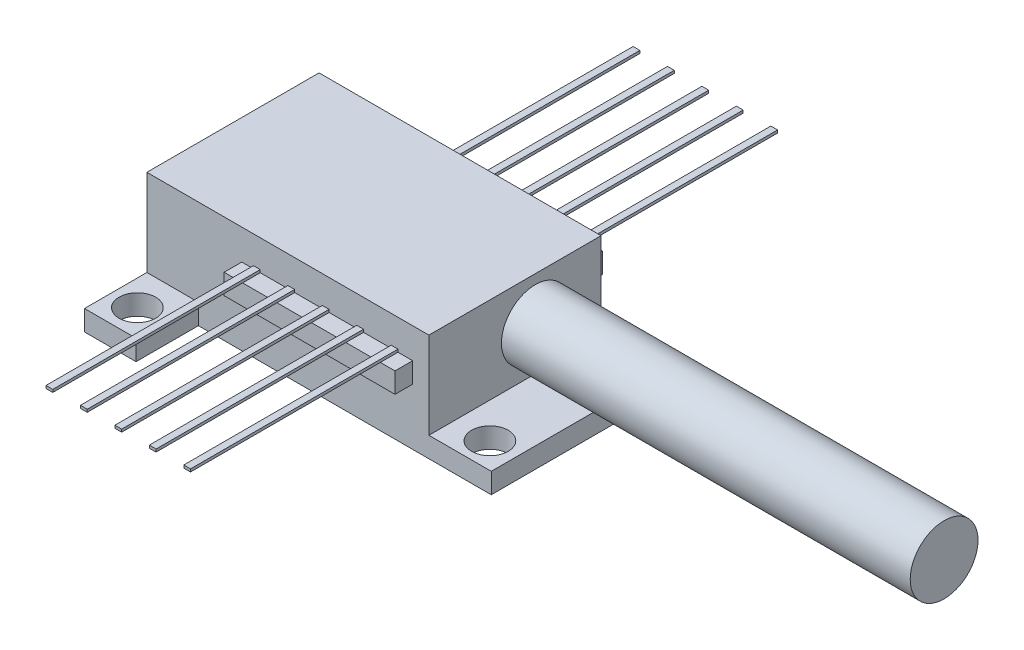
from build123d import *

# Parameters (mm, degrees)
SKETCH1_W               = 20.8
SKETCH1_H               = 12.7
BOSS_EXTRUDE1_DEPTH     = 6.4
BOSS_EXTRUDE2_DEPTH     = 1.5
SKETCH5_R               = 1.35
CUT_EXTRUDE1_DEPTH      = 21.181984541
SKETCH8_R               = 2.5
BOSS_EXTRUDE3_DEPTH     = 30.15
SKETCH9_W               = 12.6
SKETCH9_H               = 1.3
BOSS_EXTRUDE4_DEPTH     = 1.5
SKETCH10_W              = 0.5
SKETCH10_H              = 15.3
BOSS_EXTRUDE5_DEPTH     = 0.2
LPATTERN1_COUNT         = 5
LPATTERN1_PITCH         = 2.54
MIRROR2_COPY_1_SKETCH_W = 0.5
MIRROR2_COPY_1_SKETCH_H = 15.3
MIRROR2_COPY_1_DEPTH    = 0.2
MIRROR2_COPY_2_SKETCH_W = 0.5
MIRROR2_COPY_2_SKETCH_H = 15.3
MIRROR2_COPY_2_DEPTH    = 0.2
MIRROR2_COPY_3_SKETCH_W = 0.5
MIRROR2_COPY_3_SKETCH_H = 15.3
MIRROR2_COPY_3_DEPTH    = 0.2
MIRROR2_COPY_4_SKETCH_W = 0.5
MIRROR2_COPY_4_SKETCH_H = 15.3
MIRROR2_COPY_4_DEPTH    = 0.2


with BuildPart() as part:
    # Sketch1 → Boss-Extrude1 (new body)
    with BuildSketch(Plane(origin=(0, 0, 0), x_dir=(1, 0, 0), z_dir=(0, 1, 0))):
        Rectangle(SKETCH1_W, SKETCH1_H)
    extrude(amount=BOSS_EXTRUDE1_DEPTH)

    # Sketch3 → Boss-Extrude2 (add)
    with BuildSketch(Plane.XZ):
        Polygon((-10.4, 10.95), (-6.6, 10.95), (-6.6, 6.35), (15, 6.35), (15, -6.35), (-6.6, -6.35), (-6.6, -10.95), (-10.4, -10.95), align=None)
    extrude(amount=BOSS_EXTRUDE2_DEPTH)

    # Sketch5 → Cut-Extrude1 (cut, through all)
    with BuildSketch(Plane.XZ.offset(1.5)):
        with Locations(Location((-8.5, 8.95, 0), (0, 0, 270))):
            Circle(SKETCH5_R)
        with Locations(Location((13, 4.45, 0), (0, 0, 270))):
            Circle(SKETCH5_R)
    cut_extrude1 = extrude(amount=-CUT_EXTRUDE1_DEPTH, mode=Mode.SUBTRACT)

    # Mirror3: Cut-Extrude1 across plane
    add(cut_extrude1.mirror(Plane.XY), mode=Mode.SUBTRACT)

    # Sketch8 → Boss-Extrude3 (add)
    with BuildSketch(Plane(origin=(10.4, 0, 0), x_dir=(0, 0, -1), z_dir=(1, 0, 0))):
        with Locations(Location((1.5, 3.2, 0), (0, 0, 180))):
            Circle(SKETCH8_R)
    extrude(amount=BOSS_EXTRUDE3_DEPTH)

    # Sketch9 → Boss-Extrude4 (add)
    with BuildSketch(Plane(origin=(0, 2.665, 0), x_dir=(-1, 0, 0), z_dir=(0, -1, 0))):
        with Locations((-2.9, -7)):
            Rectangle(SKETCH9_W, SKETCH9_H)
    boss_extrude4 = extrude(amount=-BOSS_EXTRUDE4_DEPTH)

    # Sketch10 → Boss-Extrude5 (add)
    with BuildSketch(Plane(origin=(0, 4.165, 0), x_dir=(1, 0, 0), z_dir=(0, 1, 0))):
        with Locations((7.87, -14)):
            Rectangle(SKETCH10_W, SKETCH10_H)
    boss_extrude5 = extrude(amount=BOSS_EXTRUDE5_DEPTH)

    # LPattern1: Boss-Extrude5 ×5
    with Locations(*[(-i * LPATTERN1_PITCH, 0, 0) for i in range(1, LPATTERN1_COUNT)]):
        add(boss_extrude5)

    # Mirror2: Boss-Extrude4, Boss-Extrude5 across plane
    add(boss_extrude4.mirror(Plane.XY))
    add(boss_extrude5.mirror(Plane.XY))

    # Mirror2 copy 1 sketch → Mirror2 copy 1 (add)
    with BuildSketch(Plane(origin=(-2.54, 4.165, 0), x_dir=(1, 0, 0), z_dir=(0, 1, 0))):
        with Locations((7.87, 14)):
            Rectangle(MIRROR2_COPY_1_SKETCH_W, MIRROR2_COPY_1_SKETCH_H)
    extrude(amount=MIRROR2_COPY_1_DEPTH)

    # Mirror2 copy 2 sketch → Mirror2 copy 2 (add)
    with BuildSketch(Plane(origin=(-5.08, 4.165, 0), x_dir=(1, 0, 0), z_dir=(0, 1, 0))):
        with Locations((7.87, 14)):
            Rectangle(MIRROR2_COPY_2_SKETCH_W, MIRROR2_COPY_2_SKETCH_H)
    extrude(amount=MIRROR2_COPY_2_DEPTH)

    # Mirror2 copy 3 sketch → Mirror2 copy 3 (add)
    with BuildSketch(Plane(origin=(-7.62, 4.165, 0), x_dir=(1, 0, 0), z_dir=(0, 1, 0))):
        with Locations((7.87, 14)):
            Rectangle(MIRROR2_COPY_3_SKETCH_W, MIRROR2_COPY_3_SKETCH_H)
    extrude(amount=MIRROR2_COPY_3_DEPTH)

    # Mirror2 copy 4 sketch → Mirror2 copy 4 (add)
    with BuildSketch(Plane(origin=(-10.16, 4.165, 0), x_dir=(1, 0, 0), z_dir=(0, 1, 0))):
        with Locations((7.87, 14)):
            Rectangle(MIRROR2_COPY_4_SKETCH_W, MIRROR2_COPY_4_SKETCH_H)
    extrude(amount=MIRROR2_COPY_4_DEPTH)


solid = part.part
